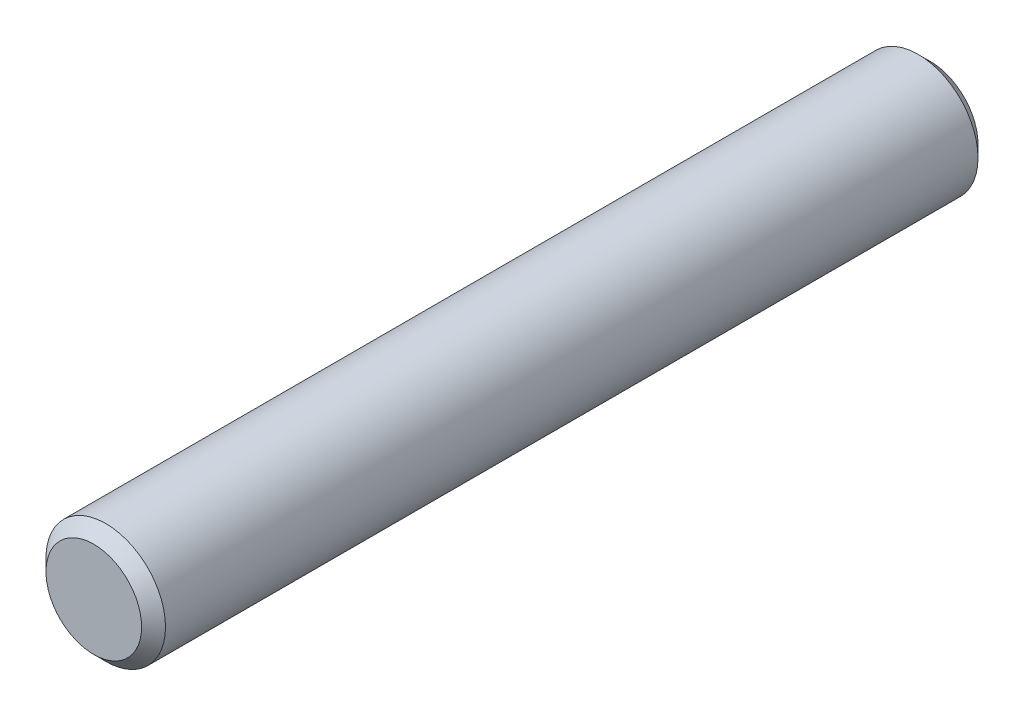
from build123d import *

# Parameters (mm, degrees)
SKETCH3_R           = 6.35
BOSS_EXTRUDE1_DEPTH = 44.45
CHAMFER1_SIZE       = 1.27


with BuildPart() as part:
    # Sketch3 → Boss-Extrude1 (new, symmetric)
    with BuildSketch(Plane.XY):
        Circle(SKETCH3_R)
    extrude(amount=BOSS_EXTRUDE1_DEPTH, both=True)

    # Chamfer1
    chamfer1_edges = [part.edges().sort_by_distance(p)[0] for p in [
        (-6.35, 0, -44.45),
        (-6.35, 0, 44.45),
    ]]
    chamfer(chamfer1_edges, length=CHAMFER1_SIZE)


solid = part.part
